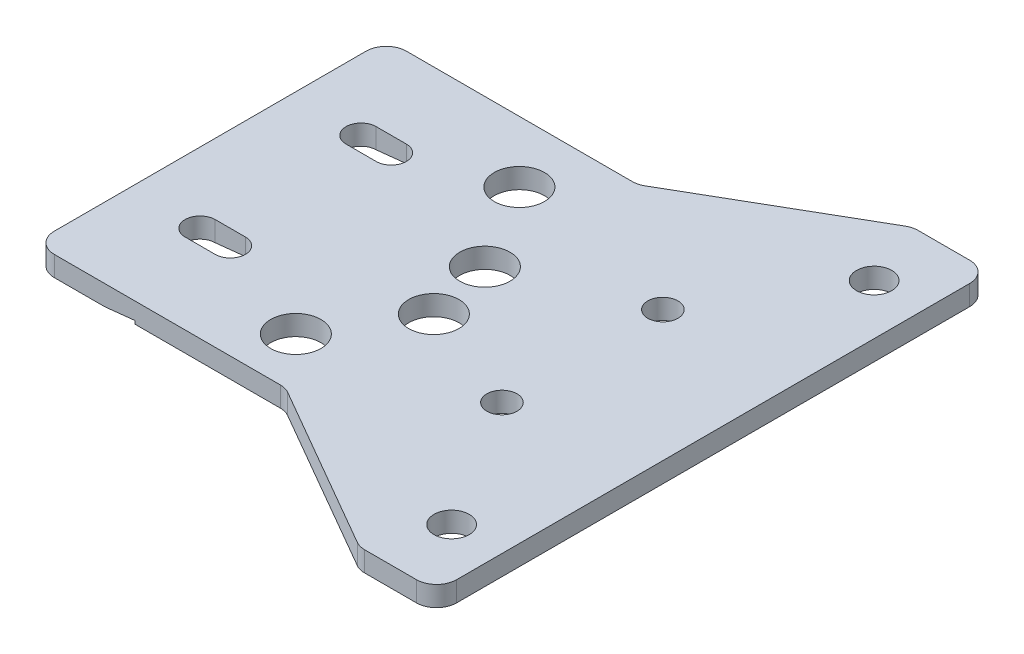
from build123d import *

# Parameters (mm, degrees)
SKETCH_1_W               = 50
SKETCH_1_H               = 55
EXTRUDE_1_DEPTH          = 2
SKETCH_2_R               = 1.5
CUT_EXTRUDE_1_DEPTH      = 38.218946788
CUT_EXTRUDE_2_DEPTH      = 10
CUT_EXTRUDE_3_DEPTH      = 44.465503563
CUT_EXTRUDE_3_DEPTH_BACK = 44.465503563
SKETCH_5_R               = 1.75
CUT_EXTRUDE_4_DEPTH      = 10
CUT_EXTRUDE_5_DEPTH      = 10
SKETCH_7_R               = 2.5
CUT_EXTRUDE_6_DEPTH      = 10
FILLET_1_R               = 2


with BuildPart() as part:
    # 草图1 → 凸台-拉伸1 (new body)
    with BuildSketch(Plane(origin=(0, 0, 0), x_dir=(1, 0, 0), z_dir=(0, 1, 0))):
        Rectangle(SKETCH_1_W, SKETCH_1_H)
    extrude(amount=EXTRUDE_1_DEPTH)

    # 草图2 → 切除-拉伸1 (cut, through all)
    with BuildSketch(Plane(origin=(0, 2, 0), x_dir=(1, 0, 0), z_dir=(0, 1, 0))):
        with Locations(Location((-18, 8, 0), (0, 0, 270))):
            Circle(SKETCH_2_R)
        with Locations(Location((-18, -8, 0), (0, 0, 270))):
            Circle(SKETCH_2_R)
        with Locations(Location((12, -8, 0), (0, 0, 270))):
            Circle(SKETCH_2_R)
        with Locations(Location((12, 8, 0), (0, 0, 270))):
            Circle(SKETCH_2_R)
    extrude(amount=-CUT_EXTRUDE_1_DEPTH, mode=Mode.SUBTRACT)

    # 草图3 → 切除-拉伸2 (cut)
    with BuildSketch(Plane.XZ):
        with BuildLine():
            Line((-18, 9.5), (-15, 9.5))
            ThreePointArc((-15, 9.5), (-13.5, 8), (-15, 6.5))
            Line((-15, 6.5), (-18, 6.5))
            Line((-18, 6.5), (-18, 9.5))
        make_face()
    cut_extrude_2 = extrude(amount=-CUT_EXTRUDE_2_DEPTH, mode=Mode.SUBTRACT)

    # 草图4 → 切除-拉伸3 (cut, two sides: drawn at the far end of the back side and taken through both)
    with BuildSketch(Plane.XY.offset(8).offset(-CUT_EXTRUDE_3_DEPTH_BACK)):
        Polygon((-18, 0), (-15, 0.315312706), (-15, 0), align=None)
    extrude(amount=CUT_EXTRUDE_3_DEPTH + CUT_EXTRUDE_3_DEPTH_BACK, mode=Mode.SUBTRACT)

    # 镜向1: 切除-拉伸2 across plane
    add(cut_extrude_2.mirror(Plane.XY), mode=Mode.SUBTRACT)

    # 草图5 → 切除-拉伸4 (cut)
    with BuildSketch(Plane(origin=(0, 2, 0), x_dir=(1, 0, 0), z_dir=(0, 1, 0))):
        with Locations(Location((20, 21, 0), (0, 0, 270))):
            Circle(SKETCH_5_R)
        with Locations(Location((20, -21, 0), (0, 0, 270))):
            Circle(SKETCH_5_R)
    extrude(amount=-CUT_EXTRUDE_4_DEPTH, mode=Mode.SUBTRACT)

    # 草图6 → 切除-拉伸5 (cut)
    with BuildSketch(Plane(origin=(0, 2, 0), x_dir=(1, 0, 0), z_dir=(0, 1, 0))):
        Polygon((-25, 17.5), (0, 17.5), (17.320508076, 27.5), (-25, 27.5), align=None)
        Polygon((17.320508076, -27.5), (-25, -27.5), (-25, -17.5), (0, -17.5), align=None)
    extrude(amount=-CUT_EXTRUDE_5_DEPTH, mode=Mode.SUBTRACT)

    # 草图7 → 切除-拉伸6 (cut)
    with BuildSketch(Plane.XZ):
        with Locations(Location((-5.685574087, -11.419607443, 0), (0, 0, 270))):
            Circle(SKETCH_7_R)
        with Locations(Location((-0.540616532, -2.844678186, 0), (0, 0, 270))):
            Circle(SKETCH_7_R)
        with Locations(Location((-4.144957554, 12.343977362, 0), (0, 0, 270))):
            Circle(SKETCH_7_R)
        with Locations(Location((1, 3.769048105, 0), (0, 0, 270))):
            Circle(SKETCH_7_R)
    extrude(amount=-CUT_EXTRUDE_6_DEPTH, mode=Mode.SUBTRACT)

    # 圆角1
    fillet_1_edges = [part.edges().sort_by_distance(p)[0] for p in [
        (17.320508076, 1, -27.5),
        (-25, 1, -17.5),
        (0, 1, -17.5),
        (0, 1, 17.5),
        (17.320508076, 1, 27.5),
        (-25, 1, 17.5),
        (25, 1, 27.5),
        (25, 1, -27.5),
    ]]
    fillet(fillet_1_edges, radius=FILLET_1_R)


solid = part.part
